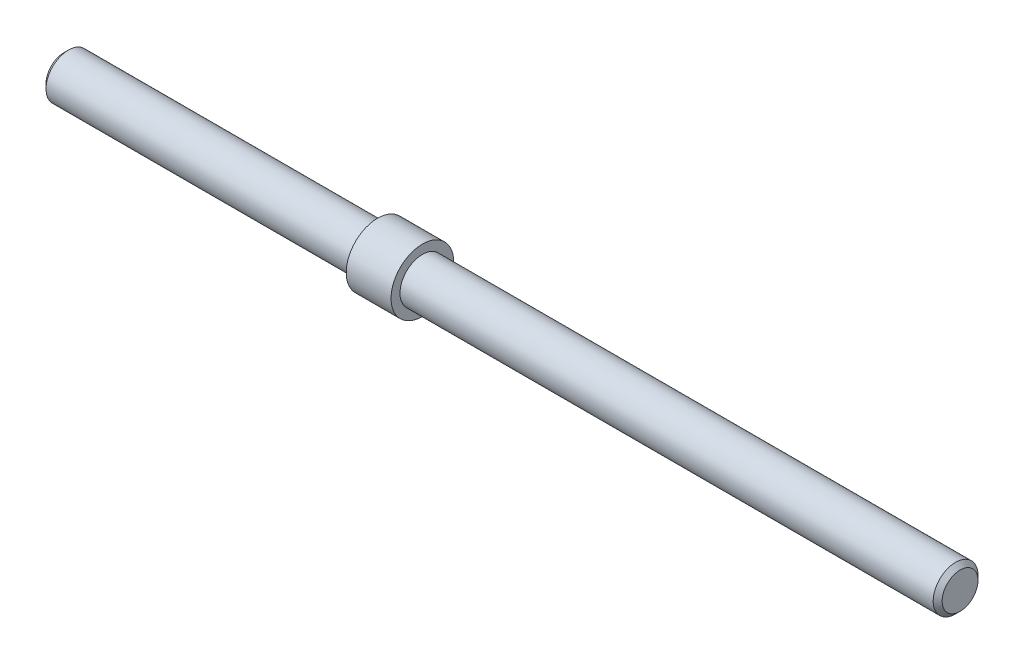
from build123d import *

# Parameters (mm, degrees)
SKETCH1_R           = 20
BOSS_EXTRUDE1_DEPTH = 800
CHAMFER1_SIZE       = 4
BOSS_EXTRUDE2_START = 280
SKETCH2_R           = 28
BOSS_EXTRUDE2_DEPTH = 40


with BuildPart() as part:
    # Sketch1 → Boss-Extrude1 (new body)
    with BuildSketch(Plane(origin=(0, 0, 0), x_dir=(0, 0, -1), z_dir=(1, 0, 0))):
        Circle(SKETCH1_R)
    extrude(amount=BOSS_EXTRUDE1_DEPTH)

    # Chamfer1
    chamfer1_edges = [part.edges().sort_by_distance(p)[0] for p in [
        (0, 0, 20),
        (800, 0, 20),
    ]]
    chamfer(chamfer1_edges, length=CHAMFER1_SIZE)

    # Sketch2 → Boss-Extrude2 (add)
    with BuildSketch(Plane(origin=(0, 0, 0), x_dir=(0, 0, -1), z_dir=(1, 0, 0)).offset(BOSS_EXTRUDE2_START)):
        Circle(SKETCH2_R)
    extrude(amount=BOSS_EXTRUDE2_DEPTH)


solid = part.part
